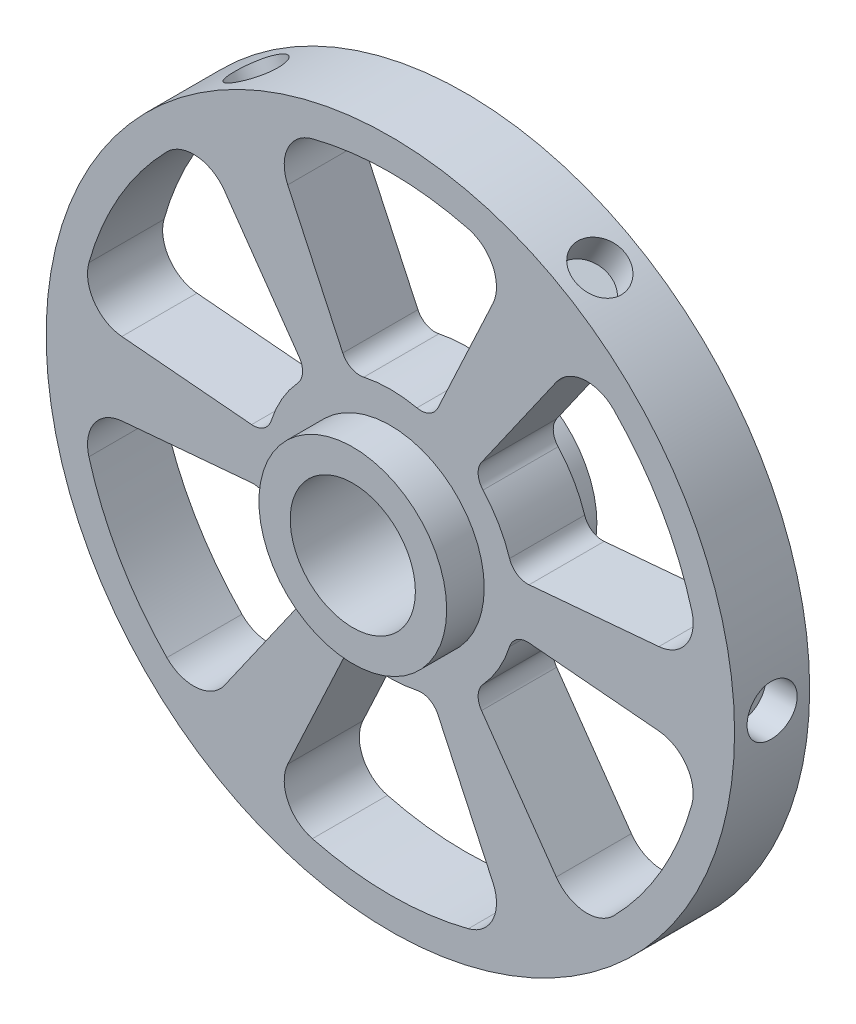
from build123d import *

# Parameters (mm, degrees)
CROQUIS1_R              = 15
CROQUIS1_R_2            = 10
SALIENTE_EXTRUIR1_DEPTH = 12
CROQUIS2_R              = 55
CROQUIS2_R_2            = 15
SALIENTE_EXTRUIR2_DEPTH = 6
CROQUIS4_R              = 4
CORTAR_EXTRUIR2_DEPTH   = 5
MATRIZC1_COUNT          = 6


with BuildPart() as part:
    # Croquis1 → Saliente-Extruir1 (new, symmetric)
    with BuildSketch(Plane.XY):
        Circle(CROQUIS1_R)
        Circle(CROQUIS1_R_2, mode=Mode.SUBTRACT)
    extrude(amount=SALIENTE_EXTRUIR1_DEPTH, both=True)

    # Croquis2 → Saliente-Extruir2 (add, symmetric)
    with BuildSketch(Plane.XY):
        Circle(CROQUIS2_R)
        Circle(CROQUIS2_R_2, mode=Mode.SUBTRACT)
        with BuildLine():
            Line((-16.39599659, 40.077890975), (-7.597218099, 21.20884961))
            ThreePointArc((-7.597218099, 21.20884961), (-6.21113479, 19.789040466), (-4.241995424, 19.544960343))
            ThreePointArc((-4.241995424, 19.544960343), (0, 20), (4.241995424, 19.544960343))
            ThreePointArc((4.241995424, 19.544960343), (6.21113479, 19.789040466), (7.597218099, 21.20884961))
            Line((7.597218099, 21.20884961), (16.39599659, 40.077890975))
            ThreePointArc((16.39599659, 40.077890975), (16.383120253, 45.176742429), (12.452443031, 48.424546075))
            ThreePointArc((12.452443031, 48.424546075), (0, 50), (-12.452443031, 48.424546075))
            ThreePointArc((-12.452443031, 48.424546075), (-16.383120253, 45.176742429), (-16.39599659, 40.077890975))
        make_face(mode=Mode.SUBTRACT)
        with BuildLine():
            Line((42.90647001, 5.83959592), (22.166011596, 4.025040933))
            ThreePointArc((22.166011596, 4.025040933), (20.243379154, 4.515519719), (19.047429885, 6.098804372))
            ThreePointArc((19.047429885, 6.098804372), (17.320508076, 10), (14.805434461, 13.446155972))
            ThreePointArc((14.805434461, 13.446155972), (14.032244365, 15.273520747), (14.568793497, 17.183808677))
            Line((14.568793497, 17.183808677), (26.51047342, 34.238295055))
            ThreePointArc((26.51047342, 34.238295055), (30.932646477, 36.776569547), (35.710665552, 34.996405042))
            ThreePointArc((35.710665552, 34.996405042), (43.301270189, 25), (48.163108583, 13.428141033))
            ThreePointArc((48.163108583, 13.428141033), (47.31576673, 8.400172882), (42.90647001, 5.83959592))
        make_face(mode=Mode.SUBTRACT)
        with BuildLine():
            Line((26.51047342, -34.238295055), (14.568793497, -17.183808677))
            ThreePointArc((14.568793497, -17.183808677), (14.032244365, -15.273520747), (14.805434461, -13.446155972))
            ThreePointArc((14.805434461, -13.446155972), (17.320508076, -10), (19.047429885, -6.098804372))
            ThreePointArc((19.047429885, -6.098804372), (20.243379154, -4.515519719), (22.166011596, -4.025040933))
            Line((22.166011596, -4.025040933), (42.90647001, -5.83959592))
            ThreePointArc((42.90647001, -5.83959592), (47.31576673, -8.400172882), (48.163108583, -13.428141033))
            ThreePointArc((48.163108583, -13.428141033), (43.301270189, -25), (35.710665552, -34.996405042))
            ThreePointArc((35.710665552, -34.996405042), (30.932646477, -36.776569547), (26.51047342, -34.238295055))
        make_face(mode=Mode.SUBTRACT)
        with BuildLine():
            Line((-16.39599659, -40.077890975), (-7.597218099, -21.20884961))
            ThreePointArc((-7.597218099, -21.20884961), (-6.21113479, -19.789040466), (-4.241995424, -19.544960343))
            ThreePointArc((-4.241995424, -19.544960343), (0, -20), (4.241995424, -19.544960343))
            ThreePointArc((4.241995424, -19.544960343), (6.21113479, -19.789040466), (7.597218099, -21.20884961))
            Line((7.597218099, -21.20884961), (16.39599659, -40.077890975))
            ThreePointArc((16.39599659, -40.077890975), (16.383120253, -45.176742429), (12.452443031, -48.424546075))
            ThreePointArc((12.452443031, -48.424546075), (0, -50), (-12.452443031, -48.424546075))
            ThreePointArc((-12.452443031, -48.424546075), (-16.383120253, -45.176742429), (-16.39599659, -40.077890975))
        make_face(mode=Mode.SUBTRACT)
        with BuildLine():
            Line((-42.90647001, -5.83959592), (-22.166011596, -4.025040933))
            ThreePointArc((-22.166011596, -4.025040933), (-20.243379154, -4.515519719), (-19.047429885, -6.098804372))
            ThreePointArc((-19.047429885, -6.098804372), (-17.320508076, -10), (-14.805434461, -13.446155972))
            ThreePointArc((-14.805434461, -13.446155972), (-14.032244365, -15.273520747), (-14.568793497, -17.183808677))
            Line((-14.568793497, -17.183808677), (-26.51047342, -34.238295055))
            ThreePointArc((-26.51047342, -34.238295055), (-30.932646477, -36.776569547), (-35.710665552, -34.996405042))
            ThreePointArc((-35.710665552, -34.996405042), (-43.301270189, -25), (-48.163108583, -13.428141033))
            ThreePointArc((-48.163108583, -13.428141033), (-47.31576673, -8.400172882), (-42.90647001, -5.83959592))
        make_face(mode=Mode.SUBTRACT)
        with BuildLine():
            Line((-26.51047342, 34.238295055), (-14.568793497, 17.183808677))
            ThreePointArc((-14.568793497, 17.183808677), (-14.032244365, 15.273520747), (-14.805434461, 13.446155972))
            ThreePointArc((-14.805434461, 13.446155972), (-17.320508076, 10), (-19.047429885, 6.098804372))
            ThreePointArc((-19.047429885, 6.098804372), (-20.243379154, 4.515519719), (-22.166011596, 4.025040933))
            Line((-22.166011596, 4.025040933), (-42.90647001, 5.83959592))
            ThreePointArc((-42.90647001, 5.83959592), (-47.31576673, 8.400172882), (-48.163108583, 13.428141033))
            ThreePointArc((-48.163108583, 13.428141033), (-43.301270189, 25), (-35.710665552, 34.996405042))
            ThreePointArc((-35.710665552, 34.996405042), (-30.932646477, 36.776569547), (-26.51047342, 34.238295055))
        make_face(mode=Mode.SUBTRACT)
    extrude(amount=SALIENTE_EXTRUIR2_DEPTH, both=True)

    # Croquis4 → Cortar-Extruir2 (cut)
    with BuildSketch(Plane(origin=(55, 0, 0), x_dir=(0, 0, -1), z_dir=(1, 0, 0))):
        Circle(CROQUIS4_R)
    cortar_extruir2 = extrude(amount=-CORTAR_EXTRUIR2_DEPTH, mode=Mode.SUBTRACT)

    # MatrizC1: Cortar-Extruir2 ×6 about axis
    matrizc1_axis = Axis((0, 0, 0), (0, 0, 1))
    for i in range(1, MATRIZC1_COUNT):
        add(cortar_extruir2.rotate(matrizc1_axis, i * 360 / MATRIZC1_COUNT), mode=Mode.SUBTRACT)


solid = part.part
